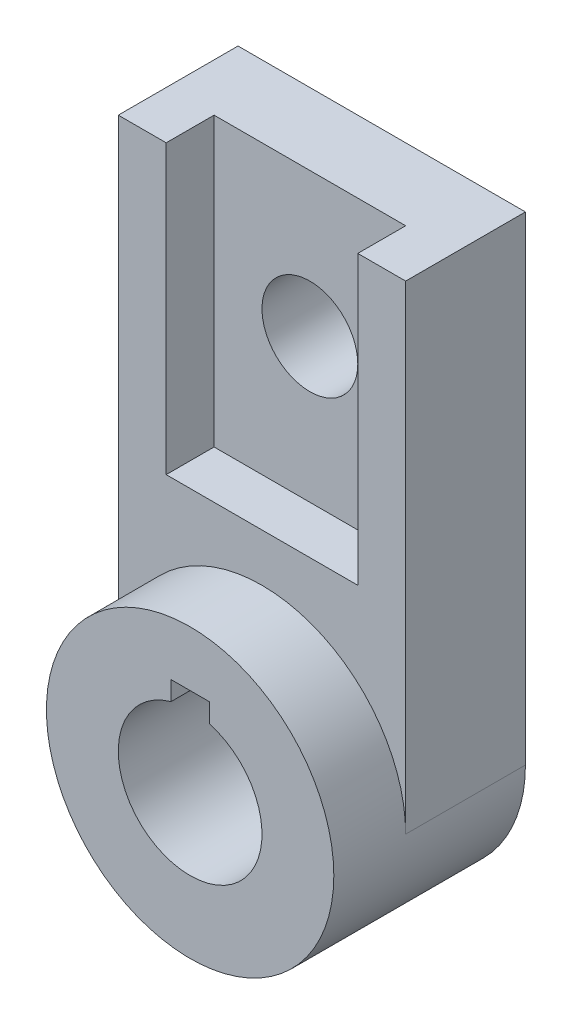
from build123d import *

# Parameters (mm, degrees)
BOSS_EXTRUDE1_DEPTH     = 25
BOSS_EXTRUDE2_DEPTH     = 40
SKETCH2_W               = 40
SKETCH2_H               = 60
CUT_EXTRUDE1_DEPTH      = 10
CUT_EXTRUDE2_DEPTH      = 108.354552768
CUT_EXTRUDE2_DEPTH_BACK = 108.354552768
SKETCH3_R               = 10
CUT_EXTRUDE3_DEPTH      = 112.803398875
CUT_EXTRUDE3_DEPTH_BACK = 112.803398875


with BuildPart() as part:
    # Sketch1 → Boss-Extrude1 (new body)
    with BuildSketch(Plane(origin=(0, 0, 0), x_dir=(0, 1, 0), z_dir=(0, 0, 1))):
        with BuildLine():
            Line((100, 30), (0, 30))
            ThreePointArc((0, 30), (21.213203436, 21.213203436), (30, 0))
            ThreePointArc((30, 0), (21.213203436, -21.213203436), (0, -30))
            Line((0, -30), (100, -30))
            Line((100, -30), (100, 30))
        make_face()
    extrude(amount=BOSS_EXTRUDE1_DEPTH)

    # Sketch1<3> → Boss-Extrude2 (add)
    with BuildSketch(Plane(origin=(0, 0, 0), x_dir=(0, 1, 0), z_dir=(0, 0, 1))):
        with BuildLine():
            ThreePointArc((30, 0), (21.213203436, 21.213203436), (0, 30))
            ThreePointArc((0, 30), (-30, 0), (0, -30))
            ThreePointArc((0, -30), (21.213203436, -21.213203436), (30, 0))
        make_face()
    extrude(amount=BOSS_EXTRUDE2_DEPTH)

    # Sketch2 → Cut-Extrude1 (cut)
    with BuildSketch(Plane.XY.offset(25)):
        with Locations((0, 70)):
            Rectangle(SKETCH2_W, SKETCH2_H)
    extrude(amount=-CUT_EXTRUDE1_DEPTH, mode=Mode.SUBTRACT)

    # Sketch3 → Cut-Extrude2 (cut, two sides: drawn at the far end of the back side and taken through both)
    with BuildSketch(Plane.XY.offset(15).offset(-CUT_EXTRUDE2_DEPTH_BACK)):
        with Locations((0, 70)):
            Circle(SKETCH3_R)
    extrude(amount=CUT_EXTRUDE2_DEPTH + CUT_EXTRUDE2_DEPTH_BACK, mode=Mode.SUBTRACT)

    # Sketch4 → Cut-Extrude3 (cut, two sides: drawn at the far end of the back side and taken through both)
    with BuildSketch(Plane.XY.offset(40).offset(-CUT_EXTRUDE3_DEPTH_BACK)):
        with BuildLine():
            Line((-4, 18.456832295), (4, 18.456832295))
            Line((4, 18.456832295), (4, 14.456832295))
            ThreePointArc((4, 14.456832295), (0, -15), (-4, 14.456832295))
            Line((-4, 14.456832295), (-4, 18.456832295))
        make_face()
    extrude(amount=CUT_EXTRUDE3_DEPTH + CUT_EXTRUDE3_DEPTH_BACK, mode=Mode.SUBTRACT)


solid = part.part
